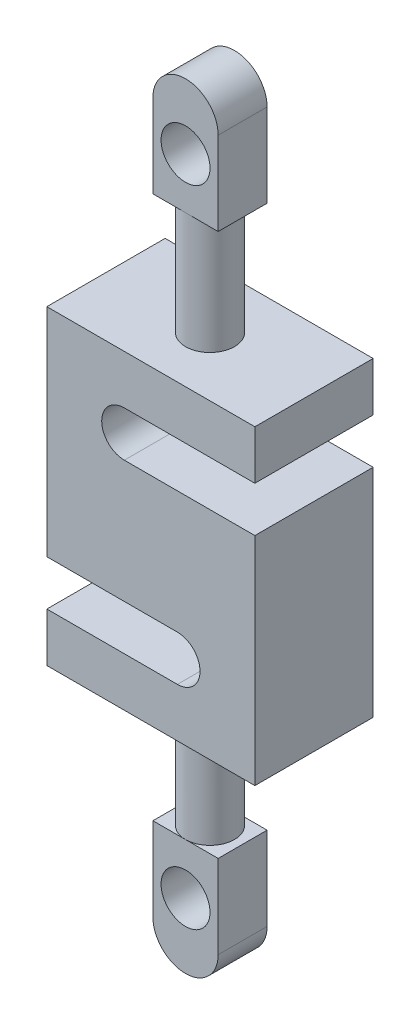
from build123d import *

# Parameters (mm, degrees)
BOSS_EXTRUDE1_DEPTH = 29
SKETCH14_R          = 6
BOSS_EXTRUDE3_DEPTH = 28.45
SKETCH15_W          = 16
SKETCH15_H          = 12
BOSS_EXTRUDE4_DEPTH = 20.45
BOSS_EXTRUDE5_START = -12
BOSS_EXTRUDE5_DEPTH = 12
SKETCH17_R          = 6
CUT_EXTRUDE1_DEPTH  = 98.063123791


with BuildPart() as part:
    # Sketch1 → Boss-Extrude1 (new body)
    with BuildSketch(Plane.XY):
        with BuildLine():
            Line((-51, -30), (-19, -30))
            ThreePointArc((-19, -30), (-13.45, -35.55), (-19, -41.1))
            Line((-19, -41.1), (-51, -41.1))
            Line((-51, -41.1), (-51, -53.1))
            Line((-51, -53.1), (0, -53.1))
            Line((0, -53.1), (0, 0))
            Line((0, 0), (-32, 0))
            ThreePointArc((-32, 0), (-37.55, 5.55), (-32, 11.1))
            Line((-32, 11.1), (0, 11.1))
            Line((0, 11.1), (0, 23.1))
            Line((0, 23.1), (-51, 23.1))
            Line((-51, 23.1), (-51, -30))
        make_face()
    extrude(amount=BOSS_EXTRUDE1_DEPTH)

    # Sketch14 → Boss-Extrude3 (add)
    with BuildSketch(Plane(origin=(0, 23.1, 0), x_dir=(1, 0, 0), z_dir=(0, 1, 0))):
        with Locations(Location((-25.5, -14.5, 0), (0, 0, 180))):
            Circle(SKETCH14_R)
    boss_extrude3 = extrude(amount=BOSS_EXTRUDE3_DEPTH)

    # Sketch15 → Boss-Extrude4 (add)
    with BuildSketch(Plane(origin=(0, 51.55, 0), x_dir=(1, 0, 0), z_dir=(0, 1, 0))):
        with Locations((-25.5, -14.5)):
            Rectangle(SKETCH15_W, SKETCH15_H)
    boss_extrude4 = extrude(amount=BOSS_EXTRUDE4_DEPTH)

    # Sketch16 → Boss-Extrude5 (add)
    with BuildSketch(Plane.XY.offset(20.5).offset(BOSS_EXTRUDE5_START)):
        with BuildLine():
            Line((-17.5, 72), (-33.5, 72))
            ThreePointArc((-33.5, 72), (-25.5, 80), (-17.5, 72))
        make_face()
    boss_extrude5 = extrude(amount=BOSS_EXTRUDE5_DEPTH)

    # Sketch17 → Cut-Extrude1 (cut, through all)
    with BuildSketch(Plane.XY.offset(20.5)):
        with Locations((-25.5, 64)):
            Circle(SKETCH17_R)
    cut_extrude1 = extrude(amount=-CUT_EXTRUDE1_DEPTH, mode=Mode.SUBTRACT)

    # Mirror7: Boss-Extrude3, Boss-Extrude4, Boss-Extrude5, Cut-Extrude1 across plane
    add(boss_extrude3.mirror(Plane.ZX.offset(-15)))
    add(boss_extrude4.mirror(Plane.ZX.offset(-15)))
    add(boss_extrude5.mirror(Plane.ZX.offset(-15)))
    add(cut_extrude1.mirror(Plane.ZX.offset(-15)), mode=Mode.SUBTRACT)


solid = part.part
